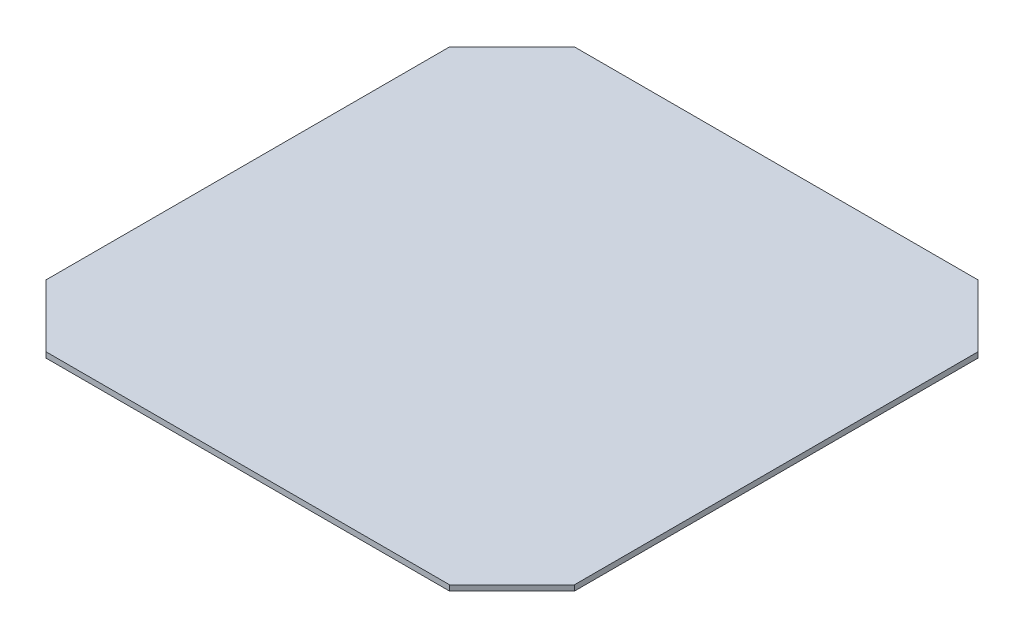
from build123d import *

# Parameters (mm, degrees)
BOSS_EXTRUDE1_DEPTH = 3.175


with BuildPart() as part:
    # Sketch1 → Boss-Extrude1 (new body)
    with BuildSketch(Plane(origin=(0, 0, 0), x_dir=(1, 0, 0), z_dir=(0, 1, 0))):
        Polygon((-25.845025354, 51.656360067), (-61.766049839, 15.735335583), (-61.766049839, -217.222615449), (-25.845025354, -253.143639933), (207.112925677, -253.143639933), (243.033950161, -217.222615449), (243.033950161, 15.735335583), (207.112925677, 51.656360067), align=None)
    extrude(amount=BOSS_EXTRUDE1_DEPTH)


solid = part.part
